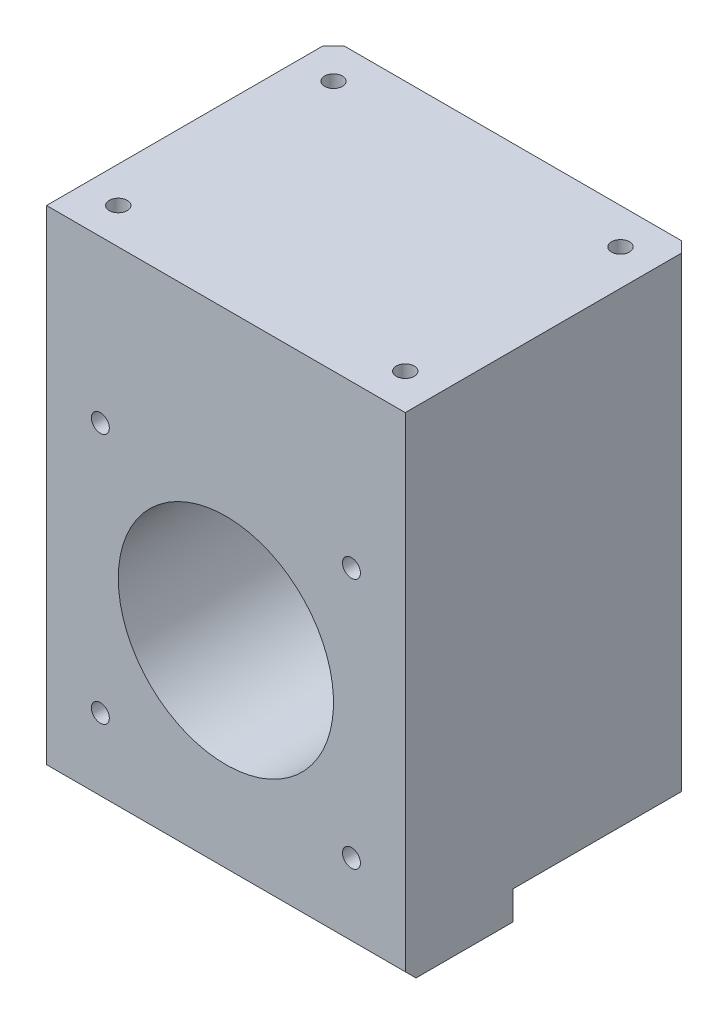
from build123d import *

# Parameters (mm, degrees)
SKETCH1_W             = 100
SKETCH1_H             = 80
BOSS_EXTRUDE1_DEPTH   = 138
SKETCH2_W             = 100
SKETCH2_H             = 50
CUT_EXTRUDE1_DEPTH    = 8
M6_TAPPED_HOLE1_D     = 5
M6_TAPPED_HOLE1_DEPTH = 15
M6_TAPPED_HOLE1_TIP   = 1.502151548
SKETCH6_R             = 30
CUT_EXTRUDE2_DEPTH    = 168.164589552
M6_TAPPED_HOLE2_D     = 5
M6_TAPPED_HOLE2_DEPTH = 15
M6_TAPPED_HOLE2_TIP   = 1.502151548
M6_TAPPED_HOLE3_D     = 5
M6_TAPPED_HOLE3_DEPTH = 10
M6_TAPPED_HOLE3_TIP   = 1.502151548
M6_TAPPED_HOLE4_D     = 5
M6_TAPPED_HOLE4_DEPTH = 15
M6_TAPPED_HOLE4_TIP   = 1.502151548
CHAMFER1_SIZE         = 3


with BuildPart() as part:
    # Sketch1 → Boss-Extrude1 (new body)
    with BuildSketch(Plane(origin=(0, 0, 0), x_dir=(1, 0, 0), z_dir=(0, 1, 0))):
        Rectangle(SKETCH1_W, SKETCH1_H)
    extrude(amount=BOSS_EXTRUDE1_DEPTH)

    # Sketch2 → Cut-Extrude1 (cut)
    with BuildSketch(Plane.XZ):
        with Locations((0, -15)):
            Rectangle(SKETCH2_W, SKETCH2_H)
    extrude(amount=-CUT_EXTRUDE1_DEPTH, mode=Mode.SUBTRACT)

    # M6 Tapped Hole1
    with Locations(Plane(origin=(0, 8, 0), x_dir=(-1, 0, 0), z_dir=(0, -1, 0))):
        with Locations((-40, 25), (-40, 0), (40, 0), (40, 25)):
            Hole(M6_TAPPED_HOLE1_D / 2, depth=M6_TAPPED_HOLE1_DEPTH)
            with Locations((0, 0, -(M6_TAPPED_HOLE1_DEPTH + M6_TAPPED_HOLE1_TIP / 2))):  # 118° drill point
                Cone(0, M6_TAPPED_HOLE1_D / 2, M6_TAPPED_HOLE1_TIP, mode=Mode.SUBTRACT)

    # Sketch6 → Cut-Extrude2 (cut, through all)
    with BuildSketch(Plane(origin=(0, 0, -40), x_dir=(-1, 0, 0), z_dir=(0, 0, -1))):
        with Locations((0, 58)):
            Circle(SKETCH6_R)
    extrude(amount=-CUT_EXTRUDE2_DEPTH, mode=Mode.SUBTRACT)

    # M6 Tapped Hole2
    with Locations(Plane(origin=(0, 138, 0), x_dir=(1, 0, 0), z_dir=(0, 1, 0))):
        with Locations((-40, 30), (-40, -30), (40, -30), (40, 30)):
            Hole(M6_TAPPED_HOLE2_D / 2, depth=M6_TAPPED_HOLE2_DEPTH)
            with Locations((0, 0, -(M6_TAPPED_HOLE2_DEPTH + M6_TAPPED_HOLE2_TIP / 2))):  # 118° drill point
                Cone(0, M6_TAPPED_HOLE2_D / 2, M6_TAPPED_HOLE2_TIP, mode=Mode.SUBTRACT)

    # M6 Tapped Hole3
    with Locations(Plane(origin=(0, 0, -40), x_dir=(-1, 0, 0), z_dir=(0, 0, -1))):
        with Locations((-35, 23), (-35, 93), (35, 93), (35, 23)):
            Hole(M6_TAPPED_HOLE3_D / 2, depth=M6_TAPPED_HOLE3_DEPTH)
            with Locations((0, 0, -(M6_TAPPED_HOLE3_DEPTH + M6_TAPPED_HOLE3_TIP / 2))):  # 118° drill point
                Cone(0, M6_TAPPED_HOLE3_D / 2, M6_TAPPED_HOLE3_TIP, mode=Mode.SUBTRACT)

    # M6 Tapped Hole4
    with Locations(Plane.XY.offset(40)):
        with Locations((-35, 93), (35, 93), (35, 23), (-35, 23)):
            Hole(M6_TAPPED_HOLE4_D / 2, depth=M6_TAPPED_HOLE4_DEPTH)
            with Locations((0, 0, -(M6_TAPPED_HOLE4_DEPTH + M6_TAPPED_HOLE4_TIP / 2))):  # 118° drill point
                Cone(0, M6_TAPPED_HOLE4_D / 2, M6_TAPPED_HOLE4_TIP, mode=Mode.SUBTRACT)

    # Chamfer1
    chamfer1_edges = [part.edges().sort_by_distance(p)[0] for p in [
        (0, 0, 40),
        (-50, 73, -40),
        (50, 73, -40),
    ]]
    chamfer(chamfer1_edges, length=CHAMFER1_SIZE)


solid = part.part
